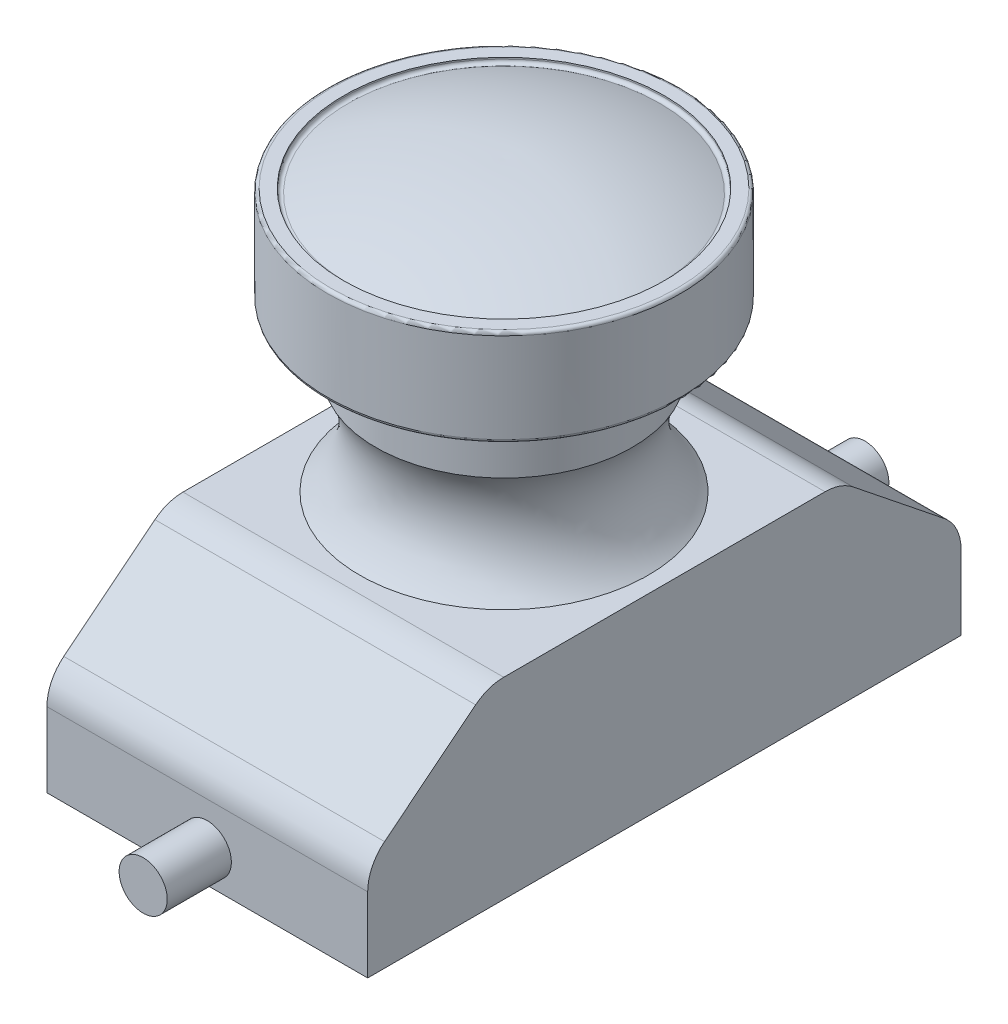
from build123d import *

# Parameters (mm, degrees)
Y_KSEKLIK_EKSTR_ZYON1_DEPTH = 5
RADYUS1_R                   = 0.1
RADYUS2_R                   = 0.1
RADYUS3_R                   = 1.4
IZIM4_R                     = 0.75
Y_KSEKLIK_EKSTR_ZYON2_DEPTH = 2


with BuildPart() as part:
    # Çizim1 → Yükseklik-Ekstrüzyon1 (new, symmetric)
    with BuildSketch(Plane(origin=(0, 0, 0), x_dir=(0, 0, -1), z_dir=(1, 0, 0))):
        Polygon((-9.25, 3), (-9.25, 0), (9.25, 0), (9.25, 3), (5.5, 6), (-5.5, 6), align=None)
    extrude(amount=Y_KSEKLIK_EKSTR_ZYON1_DEPTH, both=True)

    # Çizim2 → Döndür4 (revolve)
    with BuildSketch(Plane(origin=(0, 0, 0), x_dir=(0, 0, -1), z_dir=(1, 0, 0))):
        with BuildLine():
            Line((0, 6), (0, 14))
            Line((0, 14), (5, 14))
            Line((5, 14), (5, 14.2))
            Line((5, 14.2), (5.5, 14.2))
            Line((5.5, 14.2), (5.5, 11.2))
            Line((5.5, 11.2), (4, 11.2))
            Line((4, 11.2), (4, 9.2))
            ThreePointArc((4, 9.2), (3.661737334, 7.508083958), (4.5, 6))
            Line((4.5, 6), (0, 6))
        make_face()
    revolve(axis=Axis((0, 6, 0), (0, 1, 0)))

    # Çizim3 → Döndür6 (revolve)
    with BuildSketch(Plane(origin=(0, 0, 0), x_dir=(0, 0, -1), z_dir=(1, 0, 0))):
        with BuildLine():
            Line((0, 15), (0, 14.2))
            Line((0, 14.2), (0, 14))
            Line((0, 14), (-5, 14))
            ThreePointArc((-5, 14), (-2.553728094, 14.768640471), (0, 15))
        make_face()
    revolve(axis=Axis((0, 15, 0), (0, -1, 0)))

    # Radyus1
    radyus1_edges = [part.edges().sort_by_distance(p)[0] for p in [
        (0, 14.2, 5.5),
        (0, 11.2, 5.5),
    ]]
    fillet(radyus1_edges, radius=RADYUS1_R)

    # Radyus2
    radyus2_edges = [part.edges().sort_by_distance(p)[0] for p in [
        (5, 14, 0),
    ]]
    fillet(radyus2_edges, radius=RADYUS2_R)

    # Radyus3
    radyus3_edges = [part.edges().sort_by_distance(p)[0] for p in [
        (0, 3, 9.25),
        (0, 6, 5.5),
        (0, 6, -5.5),
        (0, 3, -9.25),
    ]]
    fillet(radyus3_edges, radius=RADYUS3_R)

    # Çizim4 → Yükseklik-Ekstrüzyon2 (add)
    with BuildSketch(Plane(origin=(0, 0, -9.25), x_dir=(-1, 0, 0), z_dir=(0, 0, -1))):
        with Locations(Location((0, 1, 0), (0, 0, 180))):
            Circle(IZIM4_R)
    y_kseklik_ekstr_zyon2 = extrude(amount=Y_KSEKLIK_EKSTR_ZYON2_DEPTH)

    # Aynalama1: Yükseklik-Ekstrüzyon2 across plane
    add(y_kseklik_ekstr_zyon2.mirror(Plane.XY))


solid = part.part
